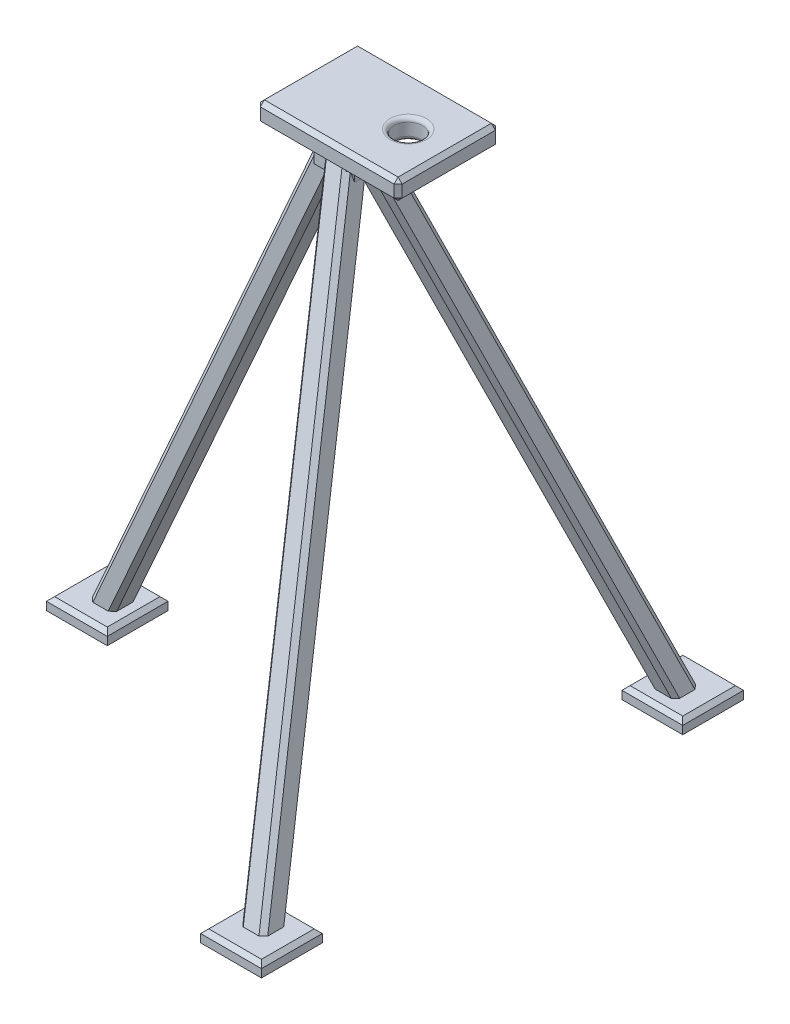
from build123d import *

# Parameters (mm, degrees)
ESBO_O1_W                = 35
ESBO_O1_H                = 25
ESBO_O1_R                = 3.5
RESSALTO_EXTRUS_O1_DEPTH = 5
RESSALTO_EXTRUS_O3_REACH = 155.332
ESBO_O8_W                = 10
ESBO_O8_H                = 10
ESBO_O9_W                = 15
ESBO_O9_H                = 15
RESSALTO_EXTRUS_O4_DEPTH = 3
CHANFRO2_SIZE            = 1
CHANFRO2_SIZE2           = 0.930333774
CHANFRO2_EDGE_2_SIZE     = 1
CHANFRO2_EDGE_2_SIZE2    = 1.088097128
CHANFRO2_EDGE_3_SIZE     = 1
CHANFRO2_EDGE_3_SIZE2    = 0.930333774
CHANFRO2_EDGE_4_SIZE     = 1
CHANFRO2_EDGE_4_SIZE2    = 1.088097128
CHANFRO2_EDGE_5_SIZE     = 1
CHANFRO2_EDGE_5_SIZE2    = 1.088097128
CHANFRO2_EDGE_6_SIZE     = 1
CHANFRO2_EDGE_6_SIZE2    = 0.930333774
CHANFRO2_EDGE_7_SIZE     = 1
CHANFRO2_EDGE_7_SIZE2    = 1.088097128
CHANFRO2_EDGE_8_SIZE     = 1
CHANFRO2_EDGE_8_SIZE2    = 0.930333774
CHANFRO2_EDGE_9_SIZE     = 1
CHANFRO2_EDGE_10_SIZE    = 1
CHANFRO2_EDGE_11_SIZE    = 1
CHANFRO2_EDGE_12_SIZE    = 1
CHANFRO3_SIZE            = 1
CHANFRO5_SIZE            = 1
FILETE1_R                = 1
CHANFRO6_SIZE            = 1


with BuildPart() as part:
    # Esboço1 → Ressalto-extrusão1 (new body)
    with BuildSketch(Plane(origin=(0, 0, 0), x_dir=(1, 0, 0), z_dir=(0, 1, 0))):
        Rectangle(ESBO_O1_W, ESBO_O1_H)
        with Locations(Location((7.5, 0, 0), (0, 0, 270))):
            Circle(ESBO_O1_R, mode=Mode.SUBTRACT)
    extrude(amount=RESSALTO_EXTRUS_O1_DEPTH)

    # Esboço5 → Loft2 section 0
    with BuildSketch(Plane.XZ):
        with BuildLine():
            Line((-3.75, 3), (-9.75, 3))
            Line((-9.75, 3), (-9.75, -3))
            Line((-9.75, -3), (-3.75, -3))
            Line((-3.75, -3), (-3.75, 3))
        make_face()
    # Esboço4 → Loft2 section 1
    with BuildSketch(Plane(origin=(0, -135, 0), x_dir=(-1, 0, 0), z_dir=(0, -1, 0))):
        with BuildLine():
            Line((63.75, 3), (69.75, 3))
            Line((69.75, 3), (69.75, -3))
            Line((69.75, -3), (63.75, -3))
            Line((63.75, -3), (63.75, 3))
        make_face()
    loft()

    # Esboço6 → Loft3 section 0
    with BuildSketch(Plane(origin=(0, -135, 0), x_dir=(-1, 0, 0), z_dir=(0, -1, 0))):
        with BuildLine():
            Line((-26.25, 54.961524227), (-20.25, 54.961524227))
            Line((-20.25, 54.961524227), (-20.25, 48.961524227))
            Line((-20.25, 48.961524227), (-26.25, 48.961524227))
            Line((-26.25, 48.961524227), (-26.25, 54.961524227))
        make_face()
    # Esboço5<4> → Loft3 section 1
    with BuildSketch(Plane.XZ):
        with BuildLine():
            Line((-3.75, 3), (-9.75, 3))
            Line((-9.75, 3), (-9.75, -3))
            Line((-9.75, -3), (-3.75, -3))
            Line((-3.75, -3), (-3.75, 3))
        make_face()
    loft()

    # Esboço7 → Loft4 section 0
    with BuildSketch(Plane(origin=(0, -135, 0), x_dir=(-1, 0, 0), z_dir=(0, -1, 0))):
        with BuildLine():
            Line((-26.25, -48.961524227), (-20.25, -48.961524227))
            Line((-20.25, -48.961524227), (-20.25, -54.961524227))
            Line((-20.25, -54.961524227), (-26.25, -54.961524227))
            Line((-26.25, -54.961524227), (-26.25, -48.961524227))
        make_face()
    # Esboço5<5> → Loft4 section 1
    with BuildSketch(Plane.XZ):
        with BuildLine():
            Line((-3.75, 3), (-9.75, 3))
            Line((-9.75, 3), (-9.75, -3))
            Line((-9.75, -3), (-3.75, -3))
            Line((-3.75, -3), (-3.75, 3))
        make_face()
    loft()

    # Ressalto-extrusão3: up to this face of the body (flat: up to its plane)
    ressalto_extrus_o3_end = Plane(part.part.faces().sort_by_distance((-0.057005549, 0, 0))[0])
    # Esboço8 → Ressalto-extrusão3 (add, up to the picked face)
    with BuildSketch(Plane(origin=(0, -10, 0), x_dir=(-1, 0, 0), z_dir=(0, -1, 0)), mode=Mode.PRIVATE) as ressalto_extrus_o3_sk1:
        with Locations((6.75, 0)):
            Rectangle(ESBO_O8_W, ESBO_O8_H)
    ressalto_extrus_o3_tool1 = split(extrude(ressalto_extrus_o3_sk1.sketch, amount=-RESSALTO_EXTRUS_O3_REACH, mode=Mode.PRIVATE), bisect_by=ressalto_extrus_o3_end, keep=Keep.BOTH, mode=Mode.PRIVATE)
    add(ressalto_extrus_o3_tool1.solids().sort_by(Axis((-6.75, -10, 0), (0, 1, 0)))[0])

    # Esboço9 → Ressalto-extrusão4 (add)
    with BuildSketch(Plane.XZ.offset(135)):
        with Locations((-66.75, 0)):
            Rectangle(ESBO_O9_W, ESBO_O9_H)
        with Locations((23.25, 51.961524227)):
            Rectangle(ESBO_O9_W, ESBO_O9_H)
        with Locations((23.25, -51.961524227)):
            Rectangle(ESBO_O9_W, ESBO_O9_H)
    extrude(amount=-RESSALTO_EXTRUS_O4_DEPTH)

    # Chanfro2
    chanfro2_edges = [part.edges().sort_by_distance(p)[0] for p in [
        (5.494016936, -68.598076211, -29.403411844),
    ]]
    chanfro2_side = [part.faces().sort_by_distance(p)[0] for p in [
        (5.943884103, -70.622478463, -27.196979504),
    ]]
    chamfer(chanfro2_edges, length=CHANFRO2_SIZE, length2=CHANFRO2_SIZE2, reference=chanfro2_side[0])

    # Chanfro2 edge 2
    chanfro2_edge_2_edges = [part.edges().sort_by_distance(p)[0] for p in [
        (6.027777778, -71, -24.327912742),
    ]]
    chanfro2_edge_2_side = [part.faces().sort_by_distance(p)[0] for p in [
        (9.026153297, -70.990691557, -24.32432992),
    ]]
    chamfer(chanfro2_edge_2_edges, length=CHANFRO2_EDGE_2_SIZE, length2=CHANFRO2_EDGE_2_SIZE2, reference=chanfro2_edge_2_side[0])

    # Chanfro2 edge 3
    chanfro2_edge_3_edges = [part.edges().sort_by_distance(p)[0] for p in [
        (11.916666667, -70.5, -24.135462652),
    ]]
    chanfro2_edge_3_side = [part.faces().sort_by_distance(p)[0] for p in [
        (11.8642345, -70.26405525, -27.054089957),
    ]]
    chamfer(chanfro2_edge_3_edges, length=CHANFRO2_EDGE_3_SIZE, length2=CHANFRO2_EDGE_3_SIZE2, reference=chanfro2_edge_3_side[0])

    # Chanfro2 edge 4
    chanfro2_edge_4_edges = [part.edges().sort_by_distance(p)[0] for p in [
        (11.494016936, -68.598076211, -29.403411844),
    ]]
    chanfro2_edge_4_side = [part.faces().sort_by_distance(p)[0] for p in [
        (8.494016936, -68.598076211, -29.403411844),
    ]]
    chamfer(chanfro2_edge_4_edges, length=CHANFRO2_EDGE_4_SIZE, length2=CHANFRO2_EDGE_4_SIZE2, reference=chanfro2_edge_4_side[0])

    # Chanfro2 edge 5
    chanfro2_edge_5_edges = [part.edges().sort_by_distance(p)[0] for p in [
        (11.494016936, -68.598076211, 29.403411844),
    ]]
    chanfro2_edge_5_side = [part.faces().sort_by_distance(p)[0] for p in [
        (11.8642345, -70.26405525, 27.054089957),
    ]]
    chamfer(chanfro2_edge_5_edges, length=CHANFRO2_EDGE_5_SIZE, length2=CHANFRO2_EDGE_5_SIZE2, reference=chanfro2_edge_5_side[0])

    # Chanfro2 edge 6
    chanfro2_edge_6_edges = [part.edges().sort_by_distance(p)[0] for p in [
        (11.916666667, -70.5, 24.135462652),
    ]]
    chanfro2_edge_6_side = [part.faces().sort_by_distance(p)[0] for p in [
        (9.026153297, -70.990691557, 24.32432992),
    ]]
    chamfer(chanfro2_edge_6_edges, length=CHANFRO2_EDGE_6_SIZE, length2=CHANFRO2_EDGE_6_SIZE2, reference=chanfro2_edge_6_side[0])

    # Chanfro2 edge 7
    chanfro2_edge_7_edges = [part.edges().sort_by_distance(p)[0] for p in [
        (6.027777778, -71, 24.327912742),
    ]]
    chanfro2_edge_7_side = [part.faces().sort_by_distance(p)[0] for p in [
        (5.943884103, -70.622478463, 27.196979504),
    ]]
    chamfer(chanfro2_edge_7_edges, length=CHANFRO2_EDGE_7_SIZE, length2=CHANFRO2_EDGE_7_SIZE2, reference=chanfro2_edge_7_side[0])

    # Chanfro2 edge 8
    chanfro2_edge_8_edges = [part.edges().sort_by_distance(p)[0] for p in [
        (5.494016936, -68.598076211, 29.403411844),
    ]]
    chanfro2_edge_8_side = [part.faces().sort_by_distance(p)[0] for p in [
        (8.494016936, -68.598076211, 29.403411844),
    ]]
    chamfer(chanfro2_edge_8_edges, length=CHANFRO2_EDGE_8_SIZE, length2=CHANFRO2_EDGE_8_SIZE2, reference=chanfro2_edge_8_side[0])

    # Chanfro2 edge 9
    chanfro2_edge_9_edges = [part.edges().sort_by_distance(p)[0] for p in [
        (-40.083333333, -68.25, -3),
    ]]
    chamfer(chanfro2_edge_9_edges, length=CHANFRO2_EDGE_9_SIZE)

    # Chanfro2 edge 10
    chanfro2_edge_10_edges = [part.edges().sort_by_distance(p)[0] for p in [
        (-40.083333333, -68.25, 3),
    ]]
    chamfer(chanfro2_edge_10_edges, length=CHANFRO2_EDGE_10_SIZE)

    # Chanfro2 edge 11
    chanfro2_edge_11_edges = [part.edges().sort_by_distance(p)[0] for p in [
        (-35.305555556, -71, 3),
    ]]
    chamfer(chanfro2_edge_11_edges, length=CHANFRO2_EDGE_11_SIZE)

    # Chanfro2 edge 12
    chanfro2_edge_12_edges = [part.edges().sort_by_distance(p)[0] for p in [
        (-35.305555556, -71, -3),
    ]]
    chamfer(chanfro2_edge_12_edges, length=CHANFRO2_EDGE_12_SIZE)

    # Chanfro3
    chanfro3_edges = [part.edges().sort_by_distance(p)[0] for p in [
        (-1.75, -10, -0.020410923),
        (-1.75, -4.5, -5),
        (-11.75, -10, -4),
        (-9.638888889, -10, -5),
        (-11.75, -5, -5),
        (-1.75, -4.5, 5),
        (-11.75, -10, 4),
        (-9.638888889, -10, 5),
        (-11.75, -5, 5),
    ]]
    chamfer(chanfro3_edges, length=CHANFRO3_SIZE)

    # Chanfro5
    chanfro5_edges = [part.edges().sort_by_distance(p)[0] for p in [
        (17.5, 5, 0),
        (0, 5, -12.5),
        (-17.5, 5, 0),
        (0, 0, -12.5),
        (17.5, 0, 0),
        (0, 0, 12.5),
        (-17.5, 0, 0),
        (-17.5, 2.5, -12.5),
        (17.5, 2.5, -12.5),
        (17.5, 2.5, 12.5),
        (-17.5, 2.5, 12.5),
        (0, 5, 12.5),
    ]]
    chamfer(chanfro5_edges, length=CHANFRO5_SIZE)

    # Filete1
    filete1_edges = [part.edges().sort_by_distance(p)[0] for p in [
        (7.5, 0, -3.5),
        (7.5, 5, -3.5),
    ]]
    fillet(filete1_edges, radius=FILETE1_R)

    # Chanfro6
    chanfro6_edges = [part.edges().sort_by_distance(p)[0] for p in [
        (-59.25, -132, 0),
        (-66.75, -132, -7.5),
        (-74.25, -132, 0),
        (-66.75, -132, 7.5),
        (30.75, -132, 51.961524227),
        (23.25, -132, 44.461524227),
        (15.75, -132, 51.961524227),
        (23.25, -132, 59.461524227),
        (30.75, -132, -51.961524227),
        (23.25, -132, -59.461524227),
        (15.75, -132, -51.961524227),
        (23.25, -132, -44.461524227),
    ]]
    chamfer(chanfro6_edges, length=CHANFRO6_SIZE)


solid = part.part
